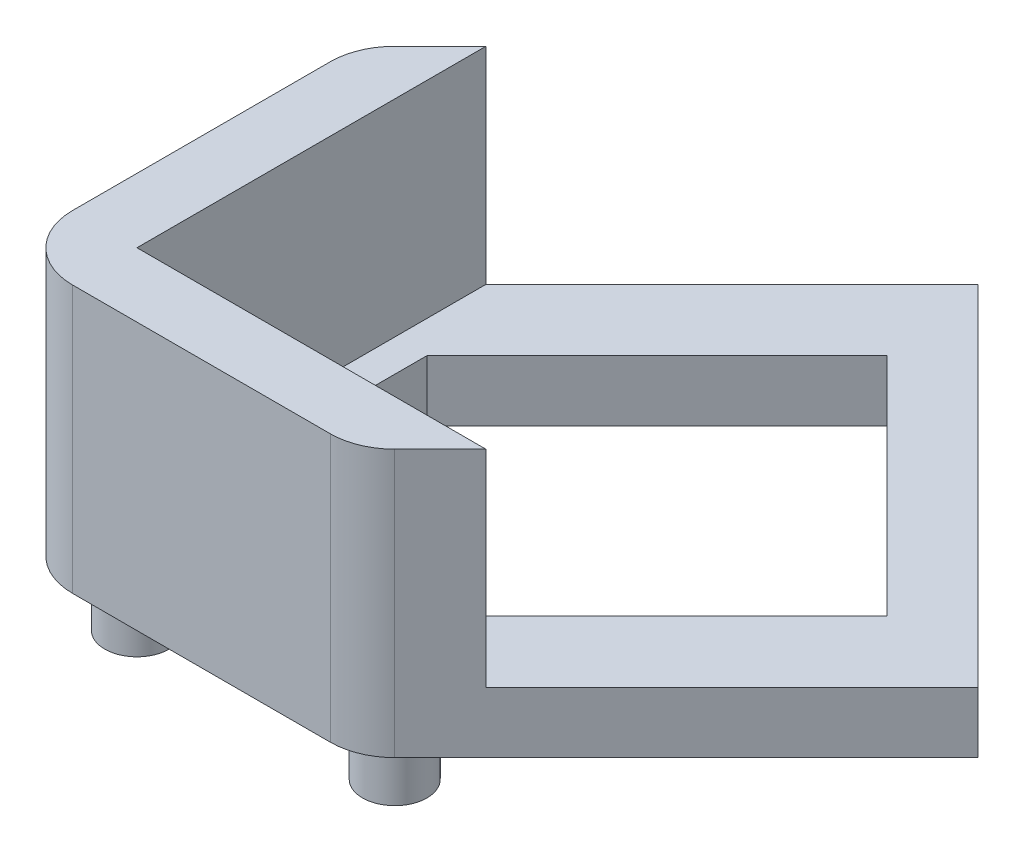
from build123d import *

# Parameters (mm, degrees)
BOSS_EXTRUDE1_DEPTH = 3
SKETCH5_R           = 1.5875
BOSS_EXTRUDE4_DEPTH = 3.175
BOSS_EXTRUDE5_DEPTH = 10.16
CUT_EXTRUDE1_DEPTH  = 10.16


with BuildPart() as part:
    # Sketch2 → Boss-Extrude1 (new body)
    with BuildSketch(Plane(origin=(0, 0, 0), x_dir=(1, 0, 0), z_dir=(0, 1, 0))):
        with BuildLine():
            Line((0, -3.175), (12.7, -3.175))
            ThreePointArc((12.7, -3.175), (13.915019898, -2.933317516), (14.94506403, -2.24506403))
            Line((14.94506403, -2.24506403), (29.313473824, 12.123345763))
            Line((29.313473824, 12.123345763), (12.123345763, 29.313473824))
            Line((12.123345763, 29.313473824), (-2.24506403, 14.94506403))
            ThreePointArc((-2.24506403, 14.94506403), (-2.933317516, 13.915019898), (-3.175, 12.7))
            Line((-3.175, 12.7), (-3.175, 0))
            ThreePointArc((-3.175, 0), (-2.24506403, -2.24506403), (0, -3.175))
        make_face()
        Polygon((24.029595763, 12.917095763), (12.7, 1.5875), (1.5875, 1.5875), (1.5875, 12.7), (12.917095763, 24.029595763), align=None, mode=Mode.SUBTRACT)
    extrude(amount=BOSS_EXTRUDE1_DEPTH)

    # Sketch5 → Boss-Extrude4 (add)
    with BuildSketch(Plane.XZ):
        with Locations(Location((0, 0, 0), (0, 0, 90))):
            Circle(SKETCH5_R)
        with Locations(Location((12.7, 0, 0), (0, 0, 270))):
            Circle(SKETCH5_R)
        with Locations((0, -12.7)):
            Circle(SKETCH5_R)
    extrude(amount=BOSS_EXTRUDE4_DEPTH)

    # Sketch6 → Boss-Extrude5 (add)
    with BuildSketch(Plane(origin=(0, 3, 0), x_dir=(1, 0, 0), z_dir=(0, 1, 0))):
        with BuildLine():
            Line((12.7, 1.5875), (1.5875, 1.5875))
            Line((1.5875, 1.5875), (1.5875, 12.7))
            Line((1.5875, 12.7), (1.5875, 18.777628061))
            Line((1.5875, 18.777628061), (-2.24506403, 14.94506403))
            ThreePointArc((-2.24506403, 14.94506403), (-2.933317516, 13.915019898), (-3.175, 12.7))
            Line((-3.175, 12.7), (-3.175, 0))
            ThreePointArc((-3.175, 0), (-2.24506403, -2.24506403), (0, -3.175))
            Line((0, -3.175), (12.7, -3.175))
            ThreePointArc((12.7, -3.175), (13.915019898, -2.933317516), (14.94506403, -2.24506403))
            Line((14.94506403, -2.24506403), (18.777628061, 1.5875))
            Line((18.777628061, 1.5875), (12.7, 1.5875))
        make_face()
    extrude(amount=BOSS_EXTRUDE5_DEPTH)

    # Sketch7 → Cut-Extrude1 (cut)
    with BuildSketch(Plane(origin=(0, 13.16, 0), x_dir=(1, 0, 0), z_dir=(0, 1, 0))):
        Polygon((1.5875, 1.5875), (1.5875, 18.777628061), (0, 17.190128061), (0, 0), (17.190128061, 0), (18.777628061, 1.5875), align=None)
    extrude(amount=-CUT_EXTRUDE1_DEPTH, mode=Mode.SUBTRACT)


solid = part.part
